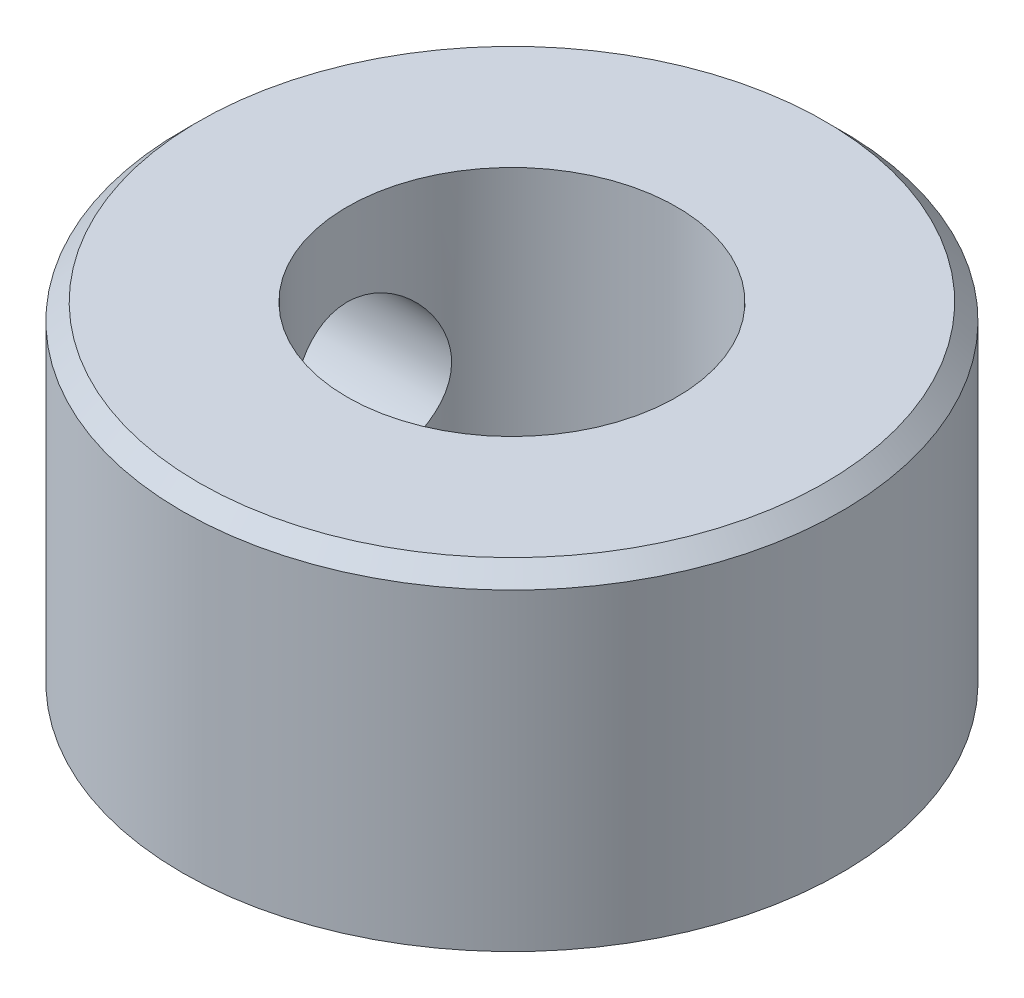
from build123d import *

# Parameters (mm, degrees)
SKETCH1_R           = 10
SKETCH1_R_2         = 5
BOSS_EXTRUDE1_DEPTH = 10
CHAMFER1_SIZE       = 0.5
CUT_EXTRUDE1_REACH  = 19.321
SKETCH19_R          = 2.5


with BuildPart() as part:
    # Sketch1 → Boss-Extrude1 (new body)
    with BuildSketch(Plane(origin=(0, 0, 0), x_dir=(1, 0, 0), z_dir=(0, 1, 0))):
        Circle(SKETCH1_R)
        Circle(SKETCH1_R_2, mode=Mode.SUBTRACT)
    extrude(amount=BOSS_EXTRUDE1_DEPTH)

    # Chamfer1
    chamfer1_edges = [part.edges().sort_by_distance(p)[0] for p in [
        (-10, 10, 0),
    ]]
    chamfer(chamfer1_edges, length=CHAMFER1_SIZE)

    # Sketch19 → Cut-Extrude1 (cut, up to next)
    with BuildSketch(Plane(origin=(0, 0, 0), x_dir=(0, 0, -1), z_dir=(1, 0, 0)), mode=Mode.PRIVATE) as cut_extrude1_sk1:
        with Locations((0, 5)):
            Circle(SKETCH19_R)
    cut_extrude1_tool1 = extrude(cut_extrude1_sk1.sketch, amount=-CUT_EXTRUDE1_REACH, mode=Mode.PRIVATE) & part.part
    add(cut_extrude1_tool1.solids().sort_by_distance((0, 5, 0))[0], mode=Mode.SUBTRACT)


solid = part.part
